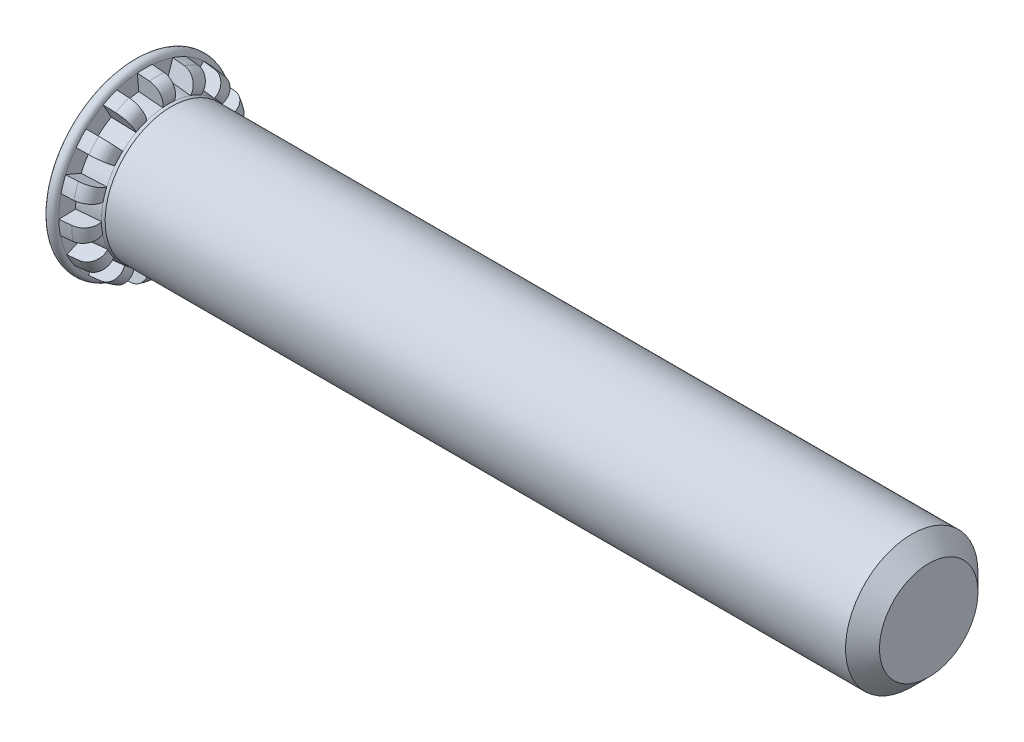
from build123d import *

# Parameters (mm, degrees)
BOSS_EXTRUDE1_START = 15
SKETCH2_R           = 2.5
BOSS_EXTRUDE1_DEPTH = 30
REVOLVE2_ANGLE      = 10
CIRPATTERN1_COUNT   = 15
CHAMFER1_SIZE       = 0.64


with BuildPart() as part:
    # Sketch2 → Boss-Extrude1 (new body)
    with BuildSketch(Plane(origin=(0, 0, 0), x_dir=(0, 0, -1), z_dir=(1, 0, 0)).offset(BOSS_EXTRUDE1_START)):
        Circle(SKETCH2_R)
    extrude(amount=-BOSS_EXTRUDE1_DEPTH)

    # Sketch5 → Revolve1 (revolve)
    with BuildSketch(Plane.XY, mode=Mode.PRIVATE) as revolve1_sk:
        with BuildLine():
            Line((-15, 0), (-15, 3.25))
            ThreePointArc((-15, 3.25), (-14.8, 3.45), (-14.6, 3.25))
            Line((-14.6, 3.25), (-14.6, 2.61341341))
            Line((-14.6, 2.61341341), (-13.702890026, 2.534926458))
            ThreePointArc((-13.702890026, 2.534926458), (-13.6, 2.5), (-13.524862675, 2.421510527))
            Line((-13.524862675, 2.421510527), (-12.126802921, 0))
            Line((-12.126802921, 0), (-15, 0))
        make_face()
    revolve(revolve1_sk.sketch.rotate(Axis((-15, 0, 0), (1, 0, 0)), 180), axis=Axis((-15, 0, 0), (1, 0, 0)))

    # Sketch6 → Revolve2 (revolve, symmetric)
    with BuildSketch(Plane.XY) as revolve2_sk:
        with BuildLine():
            Line((-14.6, 3.25), (-14.6, 0))
            Line((-14.6, 0), (-13.702890026, 0))
            Line((-13.702890026, 0), (-13.702890026, 2.534926458))
            ThreePointArc((-13.702890026, 2.534926458), (-13.764440532, 2.980844975), (-14.151445013, 3.210756524))
            Line((-14.151445013, 3.210756524), (-14.6, 3.25))
        make_face()
    revolve(axis=Axis((-14.6, 0, 0), (1, 0, 0)), revolution_arc=REVOLVE2_ANGLE / 2)
    revolve(revolve2_sk.sketch, axis=Axis((-14.6, 0, 0), (-1, 0, 0)), revolution_arc=REVOLVE2_ANGLE / 2)

    # CirPattern1: part ×15 about axis
    cirpattern1_axis = Axis((0, 0, 0), (1, 0, 0))


with BuildPart() as part_1:
    add(part.part)
    for i in range(1, CIRPATTERN1_COUNT):
        add(part.part.rotate(cirpattern1_axis, i * 360 / CIRPATTERN1_COUNT))

    # Chamfer1
    chamfer1_edges = [part_1.edges().sort_by_distance(p)[0] for p in [
        (15, 0, 2.5),
    ]]
    chamfer(chamfer1_edges, length=CHAMFER1_SIZE)


solid = part_1.part
